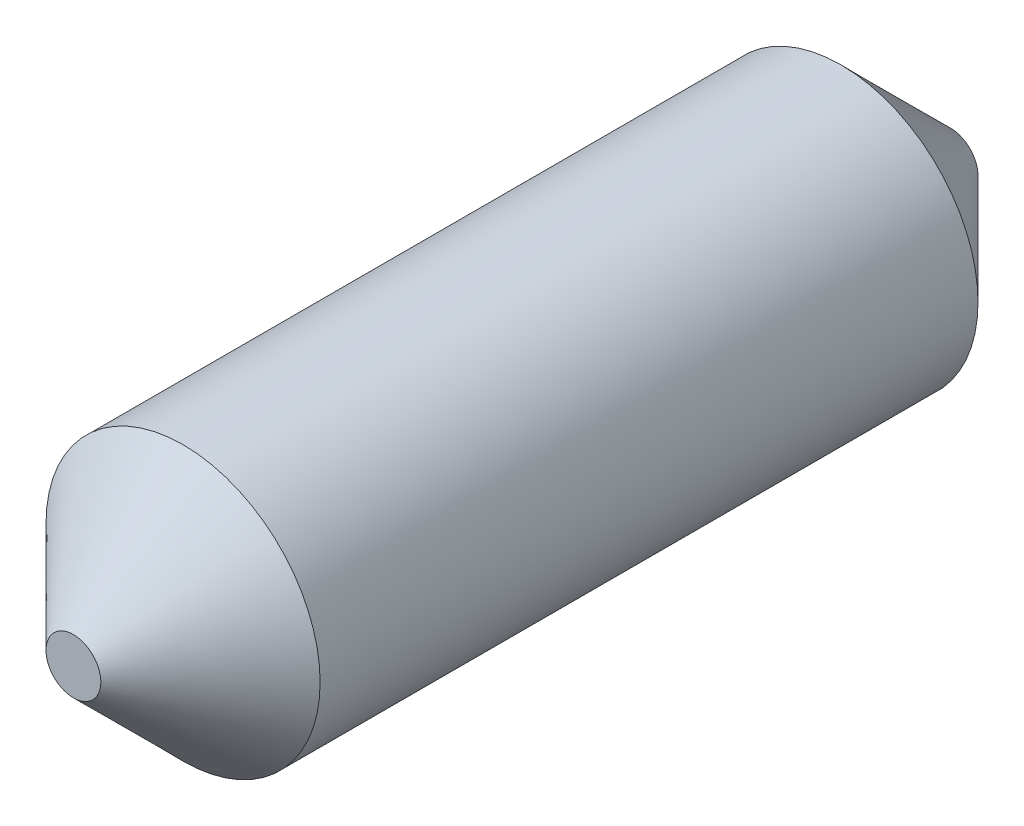
from build123d import *

# Parameters (mm, degrees)
SKETCH1_R           = 1.25
BOSS_EXTRUDE1_DEPTH = 8
CHAMFER1_SIZE       = 1


with BuildPart() as part:
    # Sketch1 → Boss-Extrude1 (new body)
    with BuildSketch(Plane.XY):
        Circle(SKETCH1_R)
    extrude(amount=BOSS_EXTRUDE1_DEPTH)

    # Chamfer1
    chamfer1_edges = [part.edges().sort_by_distance(p)[0] for p in [
        (-1.25, 0, 0),
        (-1.25, 0, 8),
    ]]
    chamfer(chamfer1_edges, length=CHAMFER1_SIZE)


solid = part.part
